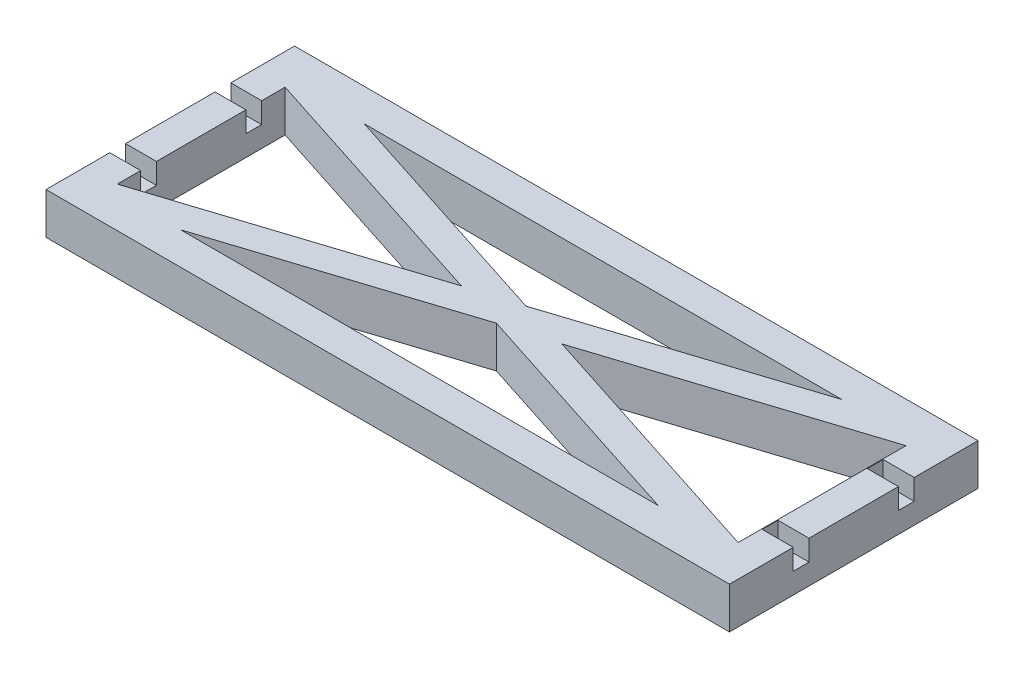
from build123d import *

# Parameters (mm, degrees)
SKETCH1_W           = 165
SKETCH1_H           = 60
BOSS_EXTRUDE1_DEPTH = 10
SKETCH2_W           = 3.81
SKETCH2_H           = 5
CUT_EXTRUDE1_DEPTH  = 7.5


with BuildPart() as part:
    # Sketch1 → Boss-Extrude1 (new body)
    with BuildSketch(Plane(origin=(0, 0, 0), x_dir=(1, 0, 0), z_dir=(0, 1, 0))):
        Rectangle(SKETCH1_W, SKETCH1_H)
        Polygon((-75.04, 20.262432489), (-75.04, -20.262432489), (-12.226459283, 0), align=None, mode=Mode.SUBTRACT)
        Polygon((57.460458264, 22.165834991), (-57.834623171, 22.165834991), (-0.187082453, 3.569854115), align=None, mode=Mode.SUBTRACT)
        Polygon((74.852917547, 20.262432489), (74.852917547, -20.262432489), (12.039376829, 0), align=None, mode=Mode.SUBTRACT)
        Polygon((-57.834623171, -22.165834991), (-0.187082453, -3.569854115), (57.460458264, -22.165834991), align=None, mode=Mode.SUBTRACT)
    extrude(amount=BOSS_EXTRUDE1_DEPTH)

    # Sketch2 → Cut-Extrude1 (cut)
    with BuildSketch(Plane.ZY.offset(82.5)):
        with Locations((-12.7, 7.5)):
            Rectangle(SKETCH2_W, SKETCH2_H)
        with Locations((12.7, 7.5)):
            Rectangle(SKETCH2_W, SKETCH2_H)
    cut_extrude1 = extrude(amount=-CUT_EXTRUDE1_DEPTH, mode=Mode.SUBTRACT)

    # Mirror1: Cut-Extrude1 across plane
    add(cut_extrude1.mirror(Plane(origin=(0, 0, 0), x_dir=(0, 0, 1), z_dir=(1, 0, 0))), mode=Mode.SUBTRACT)


solid = part.part
